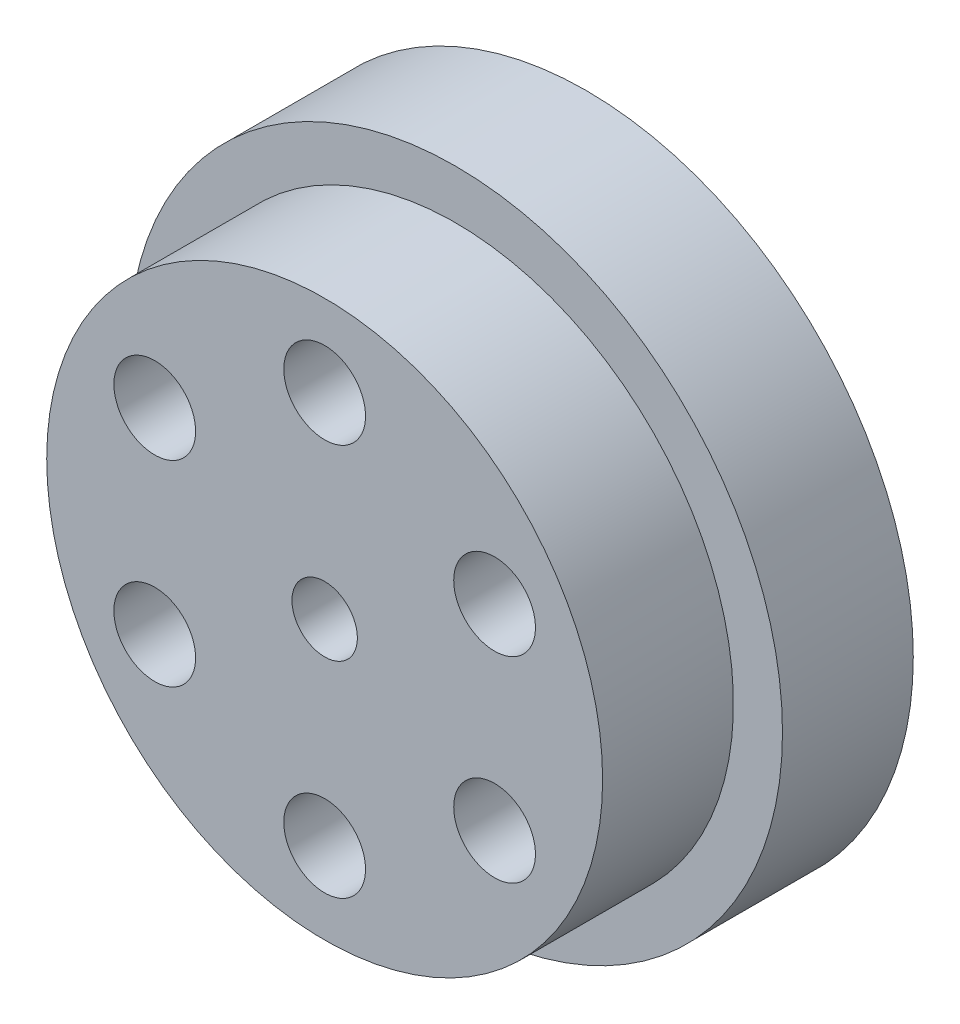
from build123d import *
from build123d.topology import SkipClean

# Parameters (mm, degrees)
SKETCH_1_R          = 8.5
SKETCH_1_R_2        = 2.5
EXTRUDE_1_DEPTH     = 5
SKETCH_2_R          = 1.25
CUT_EXTRUDE_1_DEPTH = 5
SKETCH_3_R          = 10
SKETCH_3_R_2        = 8.5
EXTRUDE_2_DEPTH     = 1
EXTRUDE_START       = 3
SKETCH_4_R          = 10
SKETCH_4_R_2        = 2.5
SKETCH_4_R_3        = 1.25
EXTRUDE_3_DEPTH     = 3
EXTRUDE_START_2     = -6
SKETCH_5_R          = 2.5
EXTRUDE_4_DEPTH     = 6
SKETCH_7_R          = 1
CUT_EXTRUDE_2_DEPTH = 10


with BuildPart() as part:
    # 草图1 → 凸台-拉伸1 (new body)
    with BuildSketch(Plane.XY):
        Circle(SKETCH_1_R)
        Circle(SKETCH_1_R_2, mode=Mode.SUBTRACT)
    extrude(amount=EXTRUDE_1_DEPTH)

    # 草图2 → 切除-拉伸1 (cut)
    with BuildSketch(Plane(origin=(0, 0, 0), x_dir=(-1, 0, 0), z_dir=(0, 0, -1))):
        with Locations((0, 6)):
            Circle(SKETCH_2_R)
        with Locations((5.196152423, 3)):
            Circle(SKETCH_2_R)
        with Locations((5.196152423, -3)):
            Circle(SKETCH_2_R)
        with Locations((0, -6)):
            Circle(SKETCH_2_R)
        with Locations((-5.196152423, -3)):
            Circle(SKETCH_2_R)
        with Locations((-5.196152423, 3)):
            Circle(SKETCH_2_R)
    extrude(amount=-CUT_EXTRUDE_1_DEPTH, mode=Mode.SUBTRACT)

    # 草图3 → 凸台-拉伸2 (add)
    with BuildSketch(Plane(origin=(0, 0, 0), x_dir=(-1, 0, 0), z_dir=(0, 0, -1))):
        Circle(SKETCH_3_R)
        Circle(SKETCH_3_R_2, mode=Mode.SUBTRACT)
    extrude(amount=-EXTRUDE_2_DEPTH)

    # 草图4 → 凸台-拉伸3 (add)
    with SkipClean():  # the faces are left unmerged after this step: merging them gives an invalid solid
        with BuildSketch(Plane(origin=(0, 0, 0), x_dir=(-1, 0, 0), z_dir=(0, 0, -1)).offset(EXTRUDE_START)):
            Circle(SKETCH_4_R)
            Circle(SKETCH_4_R_2, mode=Mode.SUBTRACT)
            with Locations((0, 6)):
                Circle(SKETCH_4_R_3, mode=Mode.SUBTRACT)
            with Locations((5.196152423, 3)):
                Circle(SKETCH_4_R_3, mode=Mode.SUBTRACT)
            with Locations((5.196152423, -3)):
                Circle(SKETCH_4_R_3, mode=Mode.SUBTRACT)
            with Locations((0, -6)):
                Circle(SKETCH_4_R_3, mode=Mode.SUBTRACT)
            with Locations((-5.196152423, -3)):
                Circle(SKETCH_4_R_3, mode=Mode.SUBTRACT)
            with Locations((-5.196152423, 3)):
                Circle(SKETCH_4_R_3, mode=Mode.SUBTRACT)
        extrude(amount=-EXTRUDE_3_DEPTH)

    # 草图5 → 凸台-拉伸4 (add)
    with BuildSketch(Plane.XY.offset(5).offset(EXTRUDE_START_2)):
        with Locations(Location((0, 0, 0), (0, 0, 180))):
            Circle(SKETCH_5_R)
    extrude(amount=EXTRUDE_4_DEPTH)

    # 草图7 → 切除-拉伸2 (cut)
    with BuildSketch(Plane(origin=(0, 0, -1), x_dir=(-1, 0, 0), z_dir=(0, 0, -1))):
        Circle(SKETCH_7_R)
    extrude(amount=-CUT_EXTRUDE_2_DEPTH, mode=Mode.SUBTRACT)


solid = part.part
